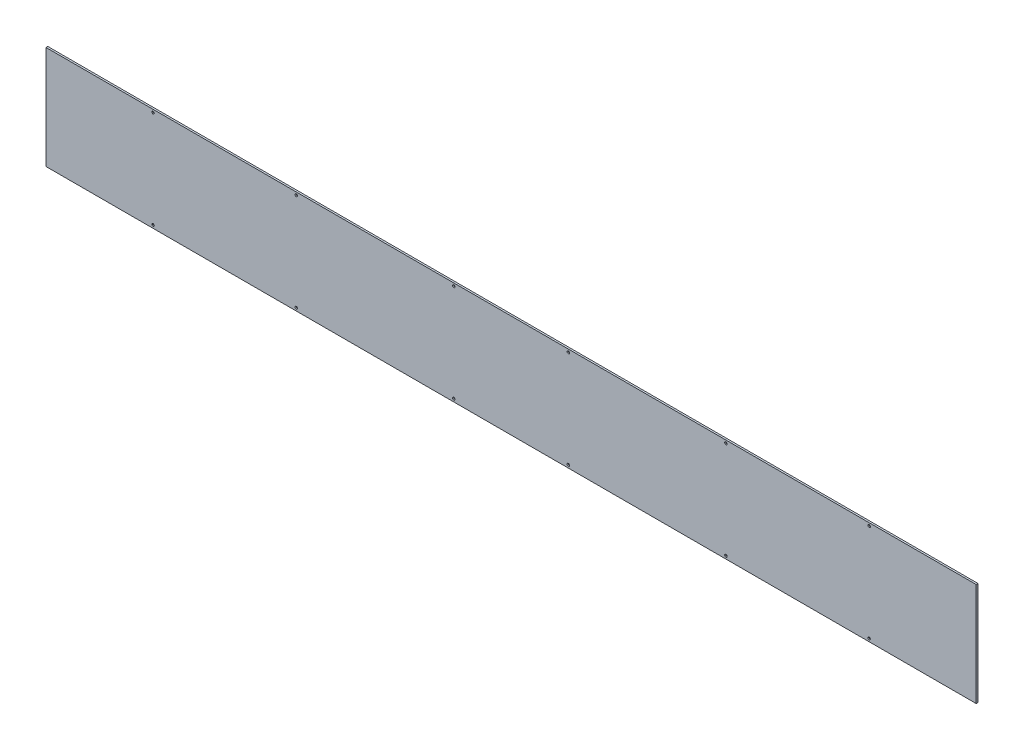
from build123d import *

# Parameters (mm, degrees)
SKETCH1_W                                       = 6495
SKETCH1_H                                       = 720
BOSS_EXTRUDE1_DEPTH                             = 12.7
CSK_FOR_M8_FLAT_HEAD_MACHINE_SCREW1_D           = 8.4
CSK_FOR_M8_FLAT_HEAD_MACHINE_SCREW1_DEPTH       = 30
CSK_FOR_M8_FLAT_HEAD_MACHINE_SCREW1_CSINK_D     = 17.3
CSK_FOR_M8_FLAT_HEAD_MACHINE_SCREW1_CSINK_ANGLE = 90
CSK_FOR_M8_FLAT_HEAD_MACHINE_SCREW1_TIP         = 2.5236146


with BuildPart() as part:
    # Sketch1 → Boss-Extrude1 (new body)
    with BuildSketch(Plane.XY):
        Rectangle(SKETCH1_W, SKETCH1_H)
    extrude(amount=BOSS_EXTRUDE1_DEPTH)

    # CSK for M8 Flat Head Machine Screw1
    with Locations(Plane.XY.offset(12.7)):
        with Locations((-2500, 340), (-1500, 340), (400, 340), (1500, 340), (2500, 340), (2500, -340), (1500, -340), (400, -340), (-1500, -340), (-2500, -340), (-400, 340), (-400, -340)):
            CounterSinkHole(CSK_FOR_M8_FLAT_HEAD_MACHINE_SCREW1_D / 2, CSK_FOR_M8_FLAT_HEAD_MACHINE_SCREW1_CSINK_D / 2, depth=CSK_FOR_M8_FLAT_HEAD_MACHINE_SCREW1_DEPTH, counter_sink_angle=CSK_FOR_M8_FLAT_HEAD_MACHINE_SCREW1_CSINK_ANGLE)
            with Locations((0, 0, -(CSK_FOR_M8_FLAT_HEAD_MACHINE_SCREW1_DEPTH + CSK_FOR_M8_FLAT_HEAD_MACHINE_SCREW1_TIP / 2))):  # 118° drill point
                Cone(0, CSK_FOR_M8_FLAT_HEAD_MACHINE_SCREW1_D / 2, CSK_FOR_M8_FLAT_HEAD_MACHINE_SCREW1_TIP, mode=Mode.SUBTRACT)


solid = part.part
